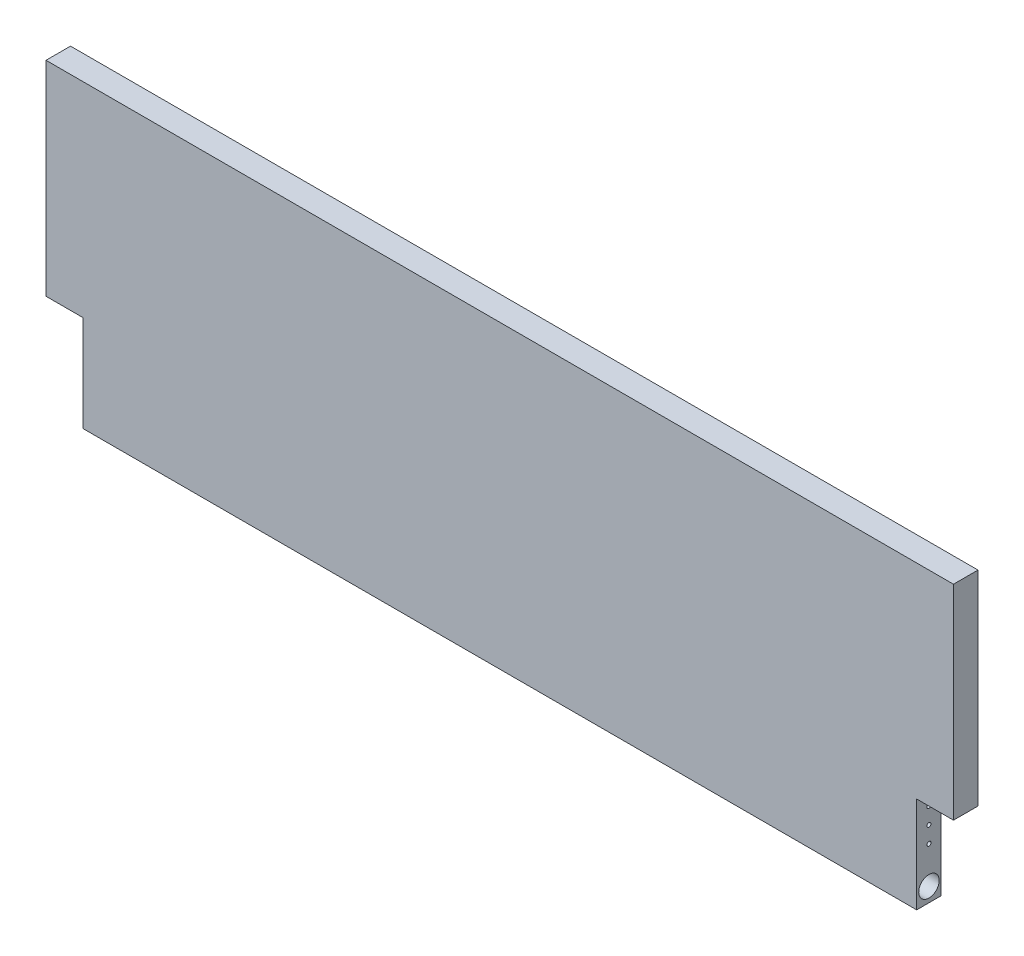
from build123d import *

# Parameters (mm, degrees)
EXTRUDE_1_DEPTH     = 102
SKETCH_2_W          = 9
SKETCH_2_H          = 50
EXTRUDE_2_DEPTH     = 6
SKETCH_3_R          = 0.5
SKETCH_3_R_2        = 2.5
CUT_EXTRUDE_1_DEPTH = 10


with BuildPart() as part:
    # 草图1 → 凸台-拉伸1 (new, symmetric)
    with BuildSketch(Plane(origin=(0, 0, 0), x_dir=(0, 0, -1), z_dir=(1, 0, 0))):
        Polygon((-3, 0), (-3, 70), (3, 70), (3, 0), (3, -3.5), (-3, -3.5), align=None)
    extrude(amount=EXTRUDE_1_DEPTH, both=True)

    # 草图2 → 凸台-拉伸2 (add)
    with BuildSketch(Plane(origin=(0, 0, -3), x_dir=(-1, 0, 0), z_dir=(0, 0, -1))):
        with Locations((106.5, 45)):
            Rectangle(SKETCH_2_W, SKETCH_2_H)
    extrude_2 = extrude(amount=-EXTRUDE_2_DEPTH)

    # 草图3 → 切除-拉伸1 (cut)
    with BuildSketch(Plane.ZY.offset(102)):
        with Locations((0, 17)):
            Circle(SKETCH_3_R)
        Circle(SKETCH_3_R_2)
        with Locations((0, 13)):
            Circle(SKETCH_3_R)
        with Locations((0, 9)):
            Circle(SKETCH_3_R)
    cut_extrude_1 = extrude(amount=-CUT_EXTRUDE_1_DEPTH, mode=Mode.SUBTRACT)

    # 镜向1: 凸台-拉伸2, 切除-拉伸1 across plane
    add(extrude_2.mirror(Plane(origin=(0, 0, 0), x_dir=(0, 0, 1), z_dir=(1, 0, 0))))
    add(cut_extrude_1.mirror(Plane(origin=(0, 0, 0), x_dir=(0, 0, 1), z_dir=(1, 0, 0))), mode=Mode.SUBTRACT)


solid = part.part
